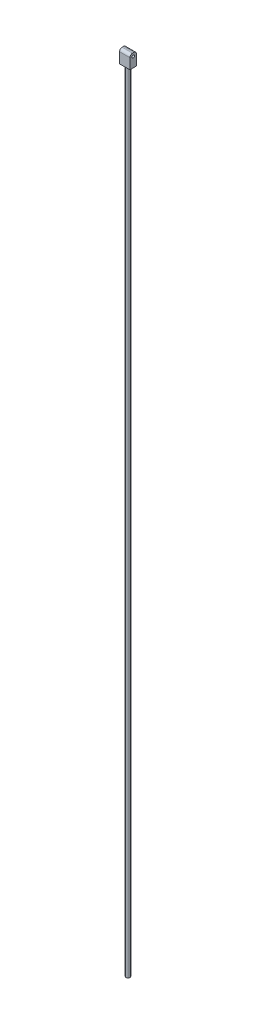
from build123d import *

# Parameters (mm, degrees)
SKETCH1_W           = 7.9
SKETCH1_H           = 10
BOSS_EXTRUDE1_DEPTH = 2.5
FILLET2_R           = 2
FILLET3_R           = 2
SKETCH4_R           = 1
CUT_EXTRUDE1_DEPTH  = 10
SKETCH5_R           = 1.5
BOSS_EXTRUDE2_DEPTH = 600


with BuildPart() as part:
    # Sketch1 → Boss-Extrude1 (new, symmetric)
    with BuildSketch(Plane.XY):
        Rectangle(SKETCH1_W, SKETCH1_H)
    extrude(amount=BOSS_EXTRUDE1_DEPTH, both=True)

    # Fillet2
    fillet2_edges = [part.edges().sort_by_distance(p)[0] for p in [
        (0, 5, -2.5),
    ]]
    fillet(fillet2_edges, radius=FILLET2_R)

    # Fillet3
    fillet3_edges = [part.edges().sort_by_distance(p)[0] for p in [
        (0, 5, 2.5),
    ]]
    fillet(fillet3_edges, radius=FILLET3_R)

    # Sketch4 → Cut-Extrude1 (cut)
    with BuildSketch(Plane(origin=(3.95, 0, 0), x_dir=(0, 0, -1), z_dir=(1, 0, 0))):
        with Locations(Location((0, 2.5, 0), (0, 0, 90))):
            Circle(SKETCH4_R)
    extrude(amount=-CUT_EXTRUDE1_DEPTH, mode=Mode.SUBTRACT)

    # Sketch5 → Boss-Extrude2 (add)
    with BuildSketch(Plane.XZ.offset(5)):
        with Locations(Location((0, 0, 0), (0, 0, 90))):
            Circle(SKETCH5_R)
    extrude(amount=BOSS_EXTRUDE2_DEPTH)


solid = part.part
